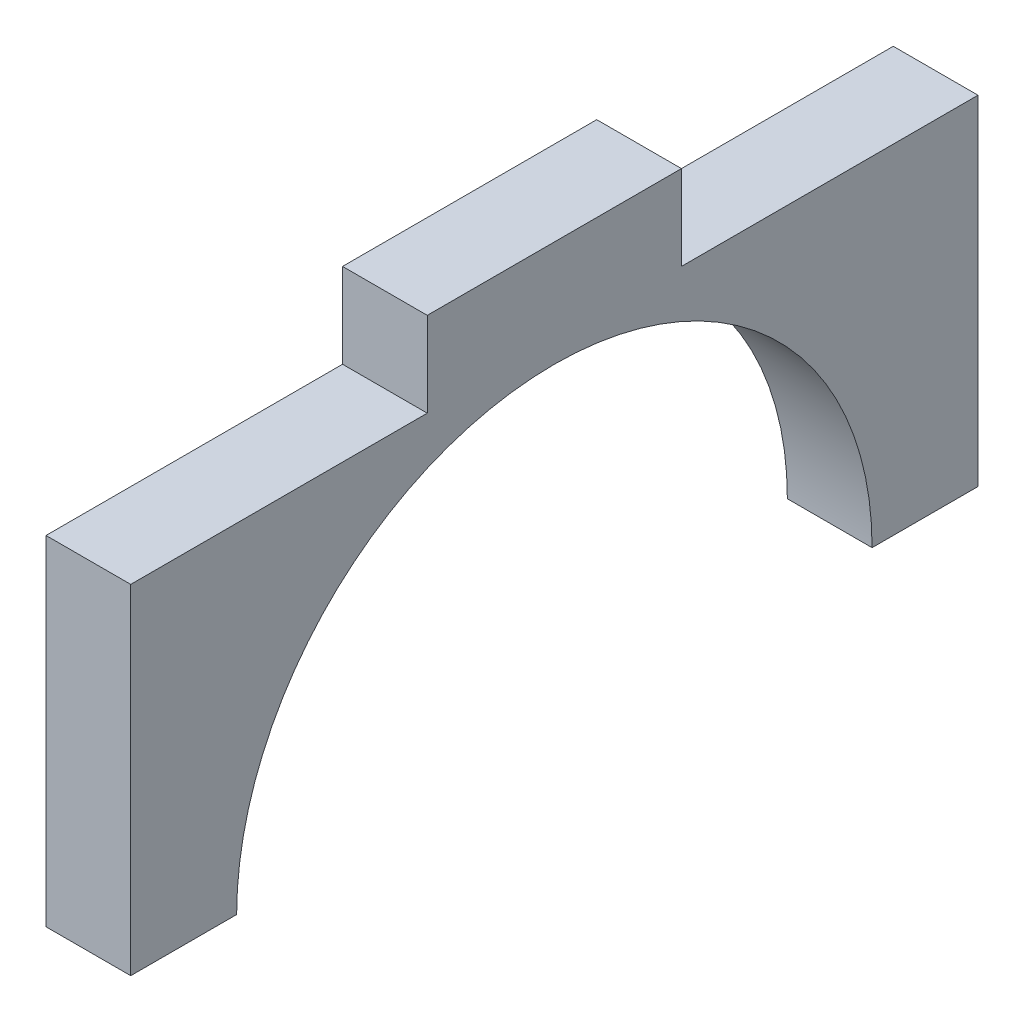
from build123d import *

# Parameters (mm, degrees)
BOSS_EXTRUDE1_DEPTH = 3.175


with BuildPart() as part:
    # Sketch1 → Boss-Extrude1 (new body)
    with BuildSketch(Plane(origin=(0, 0, 0), x_dir=(0, 0, -1), z_dir=(1, 0, 0))):
        with BuildLine():
            Line((11.1125, 12.7), (11.1125, 15.875))
            Line((11.1125, 15.875), (20.6375, 15.875))
            Line((20.6375, 15.875), (20.6375, 12.7))
            Line((20.6375, 12.7), (31.75, 12.7))
            Line((31.75, 12.7), (31.75, 0))
            Line((31.75, 0), (27.78125, 0))
            ThreePointArc((27.78125, 0), (15.875, 11.90625), (3.96875, 0))
            Line((3.96875, 0), (0, 0))
            Line((0, 0), (0, 12.7))
            Line((0, 12.7), (11.1125, 12.7))
        make_face()
    extrude(amount=BOSS_EXTRUDE1_DEPTH)


solid = part.part
